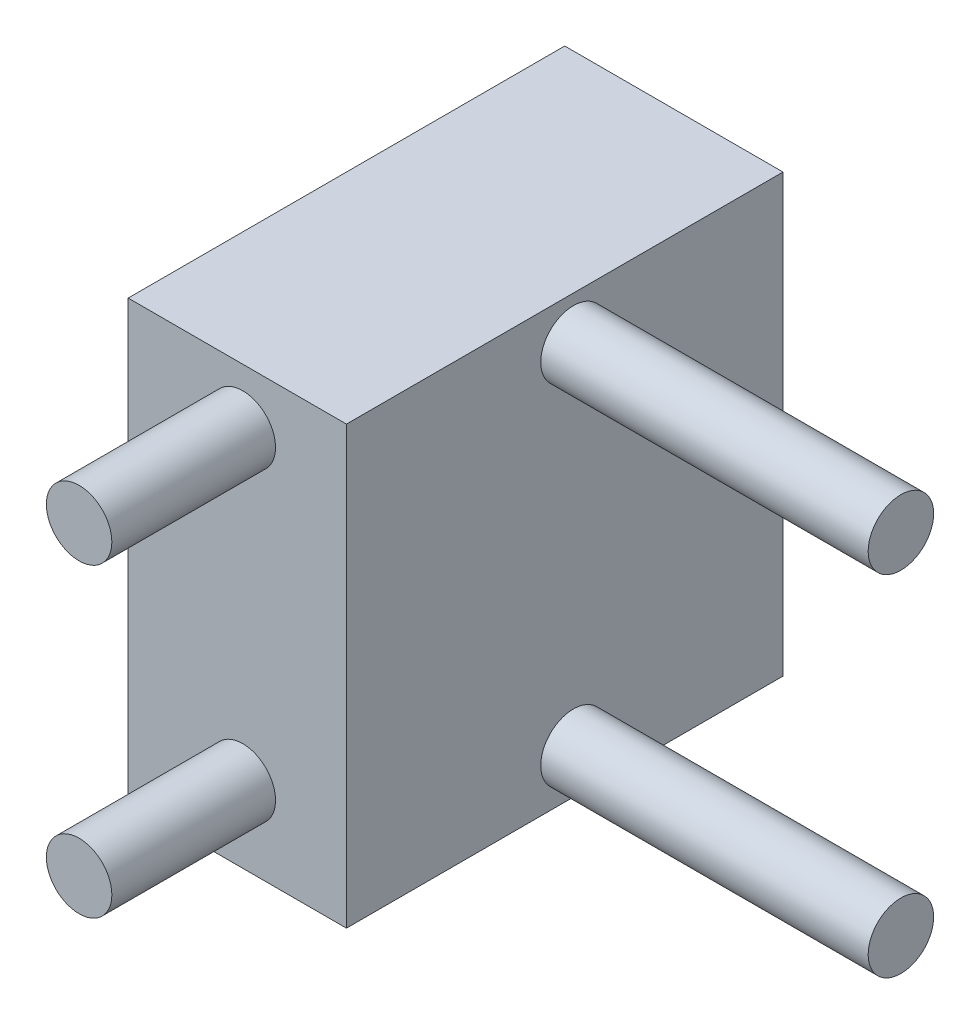
from build123d import *

# Parameters (mm, degrees)
SKETCH2_W           = 10
SKETCH2_H           = 20
BOSS_EXTRUDE1_DEPTH = 20
SKETCH3_R           = 1.5
BOSS_EXTRUDE2_DEPTH = 7.5
SKETCH6_R           = 1.5
BOSS_EXTRUDE4_DEPTH = 15
SKETCH8_R           = 1.5
BOSS_EXTRUDE5_DEPTH = 15


with BuildPart() as part:
    # Sketch2 → Boss-Extrude1 (new body)
    with BuildSketch(Plane(origin=(0, 0, 0), x_dir=(1, 0, 0), z_dir=(0, 1, 0))):
        with Locations((5, 10)):
            Rectangle(SKETCH2_W, SKETCH2_H)
    extrude(amount=BOSS_EXTRUDE1_DEPTH)

    # Sketch3 → Boss-Extrude2 (add)
    with BuildSketch(Plane.XY):
        with Locations(Location((5.252029318, 3.447237738, 0), (0, 0, 180))):
            Circle(SKETCH3_R)
        with Locations(Location((5.252029318, 17.447237738, 0), (0, 0, 180))):
            Circle(SKETCH3_R)
    extrude(amount=BOSS_EXTRUDE2_DEPTH)

    # Sketch6 → Boss-Extrude4 (add)
    with BuildSketch(Plane(origin=(10, 0, 0), x_dir=(0, 0, -1), z_dir=(1, 0, 0))):
        with Locations(Location((10.400607827, 2, 0), (0, 0, 180))):
            Circle(SKETCH6_R)
    extrude(amount=BOSS_EXTRUDE4_DEPTH)

    # Sketch8 → Boss-Extrude5 (add)
    with BuildSketch(Plane(origin=(10, 0, 0), x_dir=(0, 0, -1), z_dir=(1, 0, 0))):
        with Locations(Location((10.400607827, 18, 0), (0, 0, 180))):
            Circle(SKETCH8_R)
    extrude(amount=BOSS_EXTRUDE5_DEPTH)


solid = part.part
